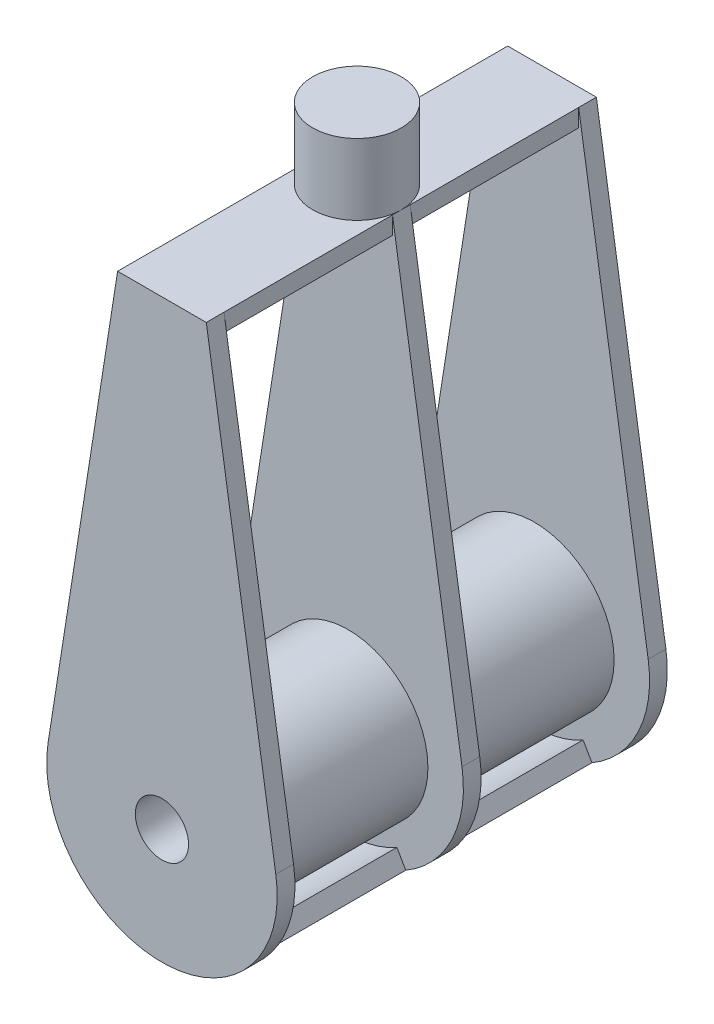
from build123d import *

# Parameters (mm, degrees)
SKETCH_1_R      = 1.5
EXTRUDE_1_DEPTH = 1
SKETCH_2_W      = 5
SKETCH_2_H      = 22
EXTRUDE_2_DEPTH = 1
EXTRUDE_START   = 21
SKETCH_1_2_R    = 1.5
EXTRUDE_3_DEPTH = 1
EXTRUDE_START_2 = 11
SKETCH_1_3_R    = 1.5
EXTRUDE_4_DEPTH = 0.5
SKETCH_3_R      = 2.5
EXTRUDE_5_DEPTH = 4
EXTRUDE_6_REACH = 39.766
EXTRUDE_7_REACH = 39.766
SKETCH_5_R      = 4.5
SKETCH_5_R_2    = 1.5


with BuildPart() as part:
    # 草图1 → 凸台-拉伸1 (new body)
    with BuildSketch(Plane.XY):
        with BuildLine():
            Line((-2.5, 26), (-6.421436, 1.007554))
            ThreePointArc((-6.421436, 1.007554), (0, -6.5), (6.421436, 1.007554))
            Line((6.421436, 1.007554), (2.5, 26))
            Line((2.5, 26), (-2.5, 26))
        make_face()
        Circle(SKETCH_1_R, mode=Mode.SUBTRACT)
    extrude(amount=EXTRUDE_1_DEPTH)

    # 草图2 → 凸台-拉伸2 (add)
    with BuildSketch(Plane(origin=(0, 26, 0), x_dir=(1, 0, 0), z_dir=(0, 1, 0))):
        with Locations((0, -11)):
            Rectangle(SKETCH_2_W, SKETCH_2_H)
    extrude(amount=-EXTRUDE_2_DEPTH)

    # 草图1<2> → 凸台-拉伸3 (add)
    with BuildSketch(Plane.XY.offset(EXTRUDE_START)):
        with BuildLine():
            Line((-2.5, 26), (-6.421436, 1.007554))
            ThreePointArc((-6.421436, 1.007554), (0, -6.5), (6.421436, 1.007554))
            Line((6.421436, 1.007554), (2.5, 26))
            Line((2.5, 26), (-2.5, 26))
        make_face()
        Circle(SKETCH_1_2_R, mode=Mode.SUBTRACT)
    extrude(amount=EXTRUDE_3_DEPTH)

    # 草图1<3> → 凸台-拉伸4 (add, symmetric)
    with BuildSketch(Plane.XY.offset(EXTRUDE_START_2)):
        with BuildLine():
            Line((-2.5, 26), (-6.421436, 1.007554))
            ThreePointArc((-6.421436, 1.007554), (0, -6.5), (6.421436, 1.007554))
            Line((6.421436, 1.007554), (2.5, 26))
            Line((2.5, 26), (-2.5, 26))
        make_face()
        Circle(SKETCH_1_3_R, mode=Mode.SUBTRACT)
    extrude(amount=EXTRUDE_4_DEPTH, both=True)

    # 草图3 → 凸台-拉伸5 (add)
    with BuildSketch(Plane(origin=(0, 26, 0), x_dir=(1, 0, 0), z_dir=(0, 1, 0))):
        with Locations(Location((0, -11, 0), (0, 0, 180))):
            Circle(SKETCH_3_R)
    extrude(amount=EXTRUDE_5_DEPTH)

    # 凸台-拉伸6: up to this face of the body (flat: up to its plane)
    extrude_6_end = Plane(part.part.faces().sort_by_distance((0, 8.21558, 22))[0])
    # 草图4 → 凸台-拉伸6 (add, up to the picked face)
    with BuildSketch(Plane(origin=(0, 0, 0), x_dir=(-1, 0, 0), z_dir=(0, 0, -1)), mode=Mode.PRIVATE) as extrude_6_sk1:
        with BuildLine():
            Line((-2.75, -4.76314), (-3.25, -5.629165))
            ThreePointArc((-3.25, -5.629165), (0, -6.5), (3.25, -5.629165))
            Line((3.25, -5.629165), (2.75, -4.76314))
            ThreePointArc((2.75, -4.76314), (0, -5.5), (-2.75, -4.76314))
        make_face()
    extrude_6_tool1 = split(extrude(extrude_6_sk1.sketch, amount=-EXTRUDE_6_REACH, mode=Mode.PRIVATE), bisect_by=extrude_6_end, keep=Keep.BOTH, mode=Mode.PRIVATE)
    add(extrude_6_tool1.solids().sort_by(Axis((0, -5.742841, 0), (0, 0, 1)))[0])

    # 凸台-拉伸7: up to this face of the body (flat: up to its plane)
    extrude_7_end = Plane(part.part.faces().sort_by_distance((0, 8.21558, 22))[0])
    # 草图5 → 凸台-拉伸7 (add, up to the picked face)
    with BuildSketch(Plane(origin=(0, 0, 0), x_dir=(-1, 0, 0), z_dir=(0, 0, -1)), mode=Mode.PRIVATE) as extrude_7_sk1:
        with Locations(Location((0, 0, 0), (0, 0, 180))):
            Circle(SKETCH_5_R)
        with Locations(Location((0, 0, 0), (0, 0, 180))):
            Circle(SKETCH_5_R_2, mode=Mode.SUBTRACT)
    extrude_7_tool1 = split(extrude(extrude_7_sk1.sketch, amount=-EXTRUDE_7_REACH, mode=Mode.PRIVATE), bisect_by=extrude_7_end, keep=Keep.BOTH, mode=Mode.PRIVATE)
    add(extrude_7_tool1.solids().sort_by(Axis((-4.372721, 0, 0), (0, 0, 1)))[0])


solid = part.part
